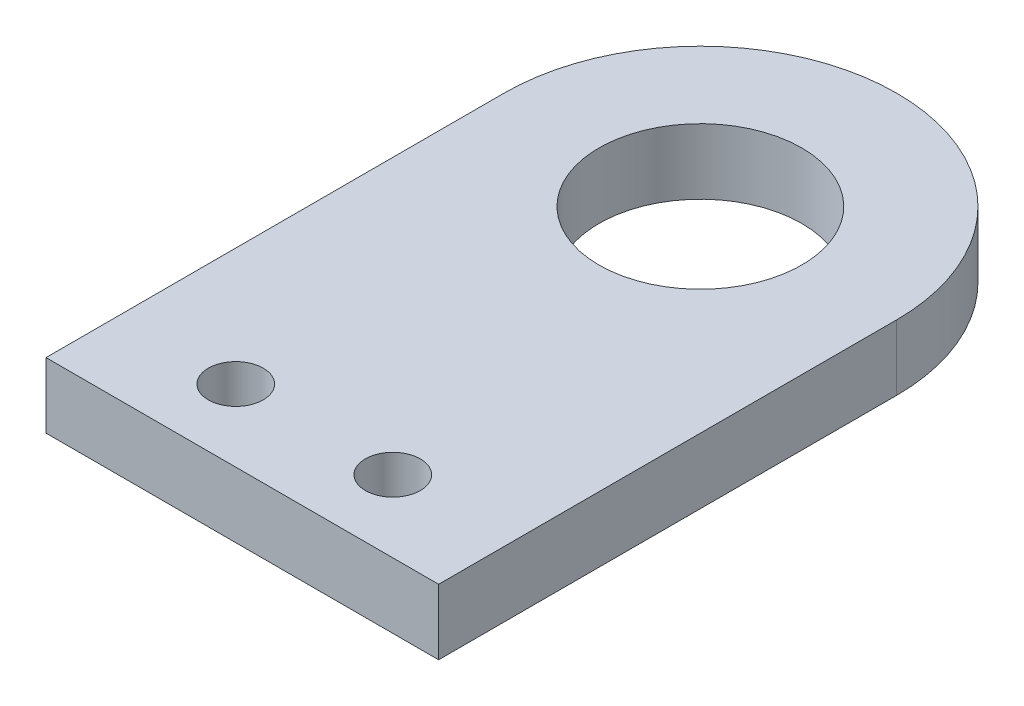
from build123d import *

# Parameters (mm, degrees)
SKETCH_1_R      = 7.75
SKETCH_1_R_2    = 2.1
EXTRUDE_1_DEPTH = 5


with BuildPart() as part:
    # 草图1 → 凸台-拉伸1 (new body)
    with BuildSketch(Plane(origin=(0, 0, 0), x_dir=(1, 0, 0), z_dir=(0, 1, 0))):
        with BuildLine():
            Line((15, 0), (15, 35))
            ThreePointArc((15, 35), (0, 50), (-15, 35))
            Line((-15, 35), (-15, 0))
            Line((-15, 0), (15, 0))
        make_face()
        with Locations(Location((0, 35, 0), (0, 0, 270))):
            Circle(SKETCH_1_R, mode=Mode.SUBTRACT)
        with Locations(Location((-6, 5.5, 0), (0, 0, 270))):
            Circle(SKETCH_1_R_2, mode=Mode.SUBTRACT)
        with Locations(Location((6, 5.5, 0), (0, 0, 270))):
            Circle(SKETCH_1_R_2, mode=Mode.SUBTRACT)
    extrude(amount=EXTRUDE_1_DEPTH)


solid = part.part
